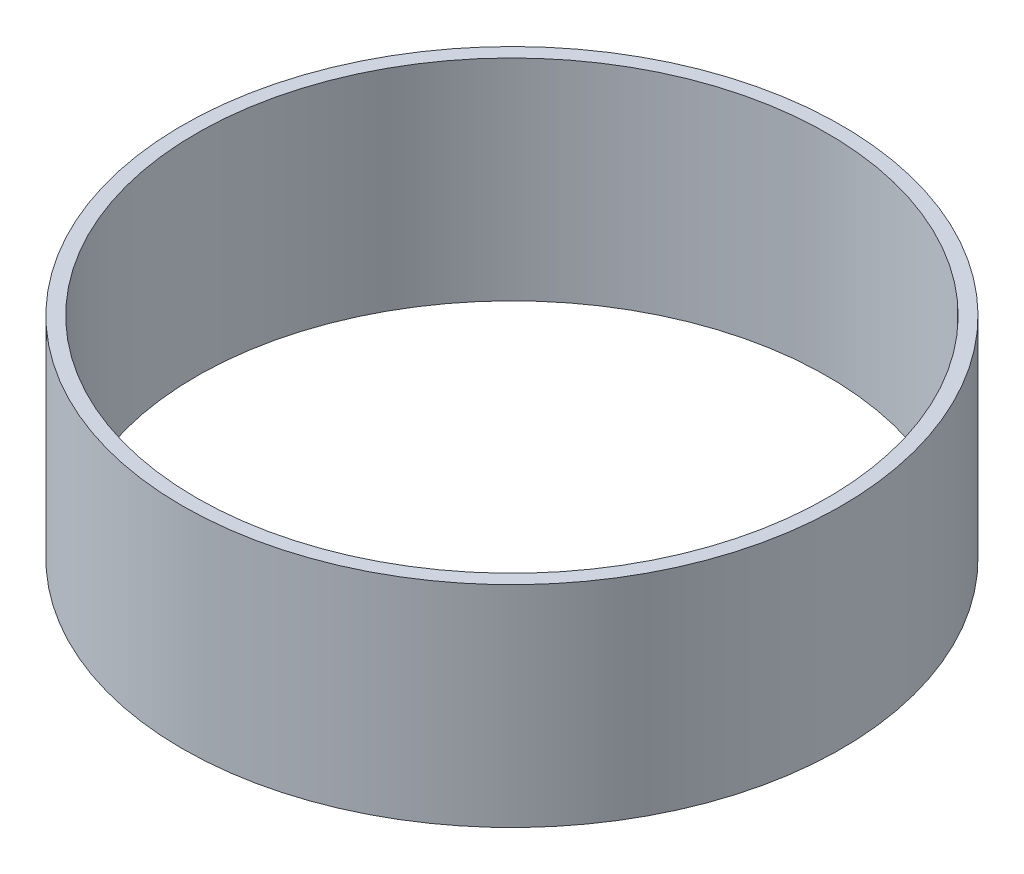
from build123d import *

# Parameters (mm, degrees)
SKETCH3_R           = 23.5044
SKETCH3_R_2         = 22.5044
BOSS_EXTRUDE2_DEPTH = 15


with BuildPart() as part:
    # Sketch3 → Boss-Extrude2 (new body)
    with BuildSketch(Plane(origin=(0, 0, 0), x_dir=(1, 0, 0), z_dir=(0, 1, 0))):
        with Locations(Location((0, 0, 0), (0, 0, 270))):
            Circle(SKETCH3_R)
        with Locations(Location((0, 0, 0), (0, 0, 270))):
            Circle(SKETCH3_R_2, mode=Mode.SUBTRACT)
    extrude(amount=BOSS_EXTRUDE2_DEPTH)


solid = part.part
